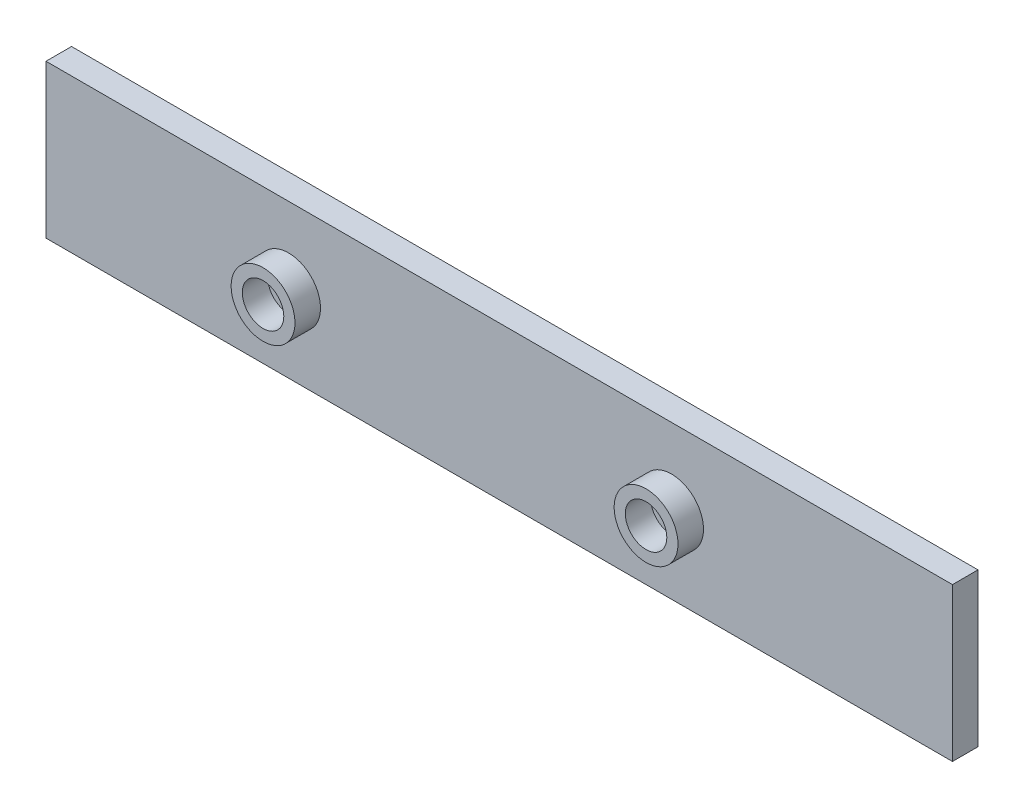
from build123d import *

# Parameters (mm, degrees)
SKETCH1_W           = 71
SKETCH1_H           = 12
BOSS_EXTRUDE1_DEPTH = 2
SKETCH2_R           = 2.5
SKETCH2_R_2         = 1.625
BOSS_EXTRUDE2_DEPTH = 2


with BuildPart() as part:
    # Sketch1 → Boss-Extrude1 (new body)
    with BuildSketch(Plane.XY):
        with Locations((35.5, 6)):
            Rectangle(SKETCH1_W, SKETCH1_H)
    extrude(amount=BOSS_EXTRUDE1_DEPTH)

    # Sketch2 → Boss-Extrude2 (add)
    # profile 1 of 2: a face of its own
    with BuildSketch(Plane.XY.offset(2)):
        with Locations(Location((19, 6, 0), (0, 0, 180))):
            Circle(SKETCH2_R)
        with Locations((19, 6)):
            Circle(SKETCH2_R_2, mode=Mode.SUBTRACT)
    # profile 2 of 2: a face of its own
    with BuildSketch(Plane.XY.offset(2)):
        with Locations(Location((49, 6, 0), (0, 0, 180))):
            Circle(SKETCH2_R)
        with Locations((49, 6)):
            Circle(SKETCH2_R_2, mode=Mode.SUBTRACT)
    extrude(amount=BOSS_EXTRUDE2_DEPTH)


solid = part.part
